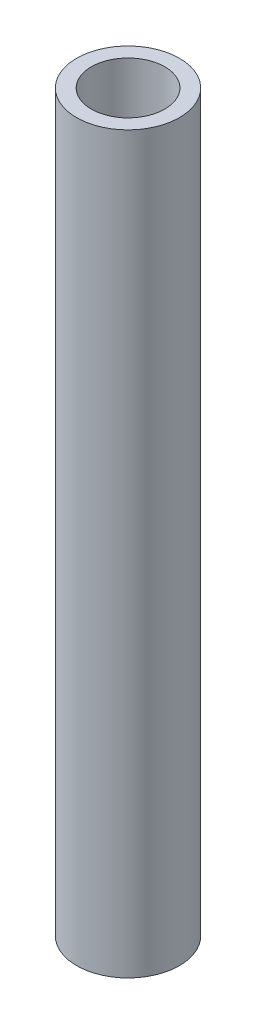
from build123d import *

# Parameters (mm, degrees)
SKETCH1_W = 0.6
SKETCH1_H = 30


with BuildPart() as part:
    # Sketch1 → Revolve1 (revolve)
    with BuildSketch(Plane.XY, mode=Mode.PRIVATE) as revolve1_sk:
        with Locations((-1.8, 15)):
            Rectangle(SKETCH1_W, SKETCH1_H)
    revolve(revolve1_sk.sketch.rotate(Axis((0, 0, 0), (0, 1, 0)), 270), axis=Axis((0, 0, 0), (0, 1, 0)))


solid = part.part
